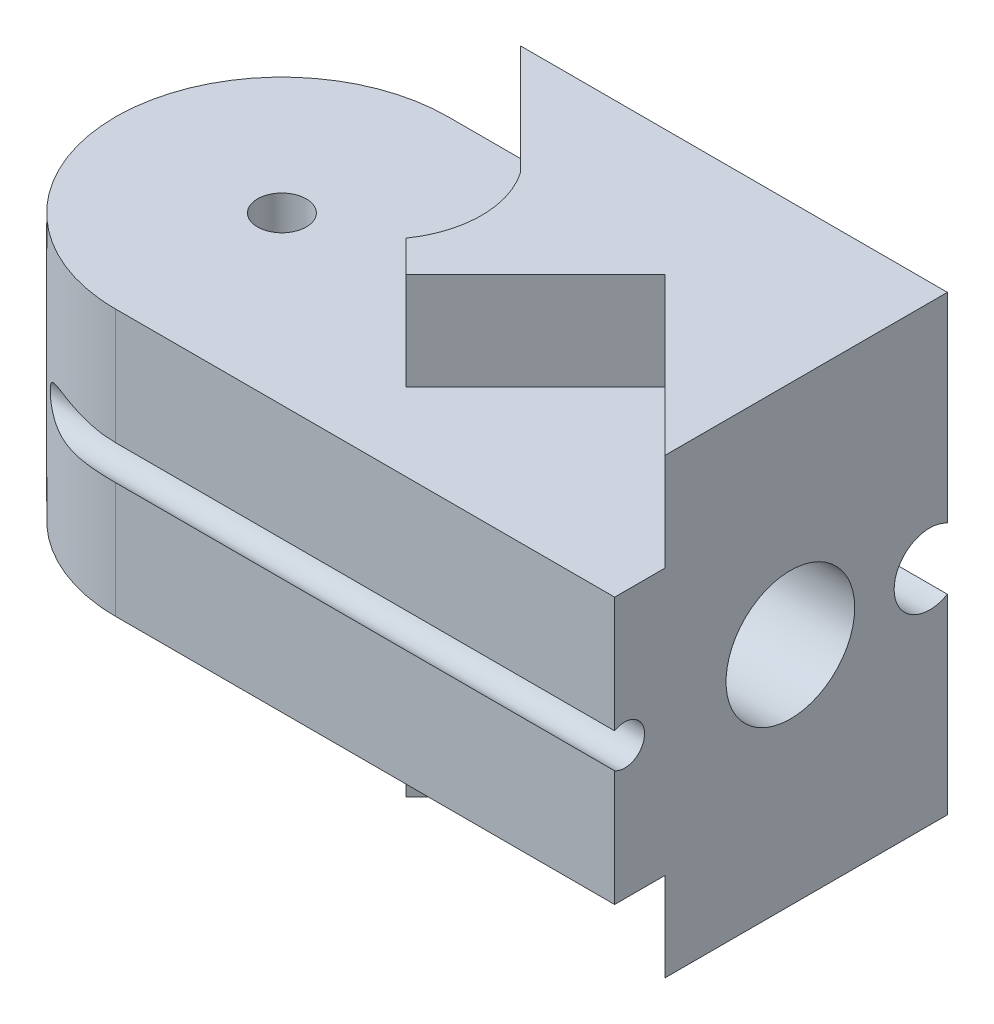
from build123d import *

# Parameters (mm, degrees)
BOSS_EXTRUDE1_DEPTH                  = 16
CUT_EXTRUDE1_DEPTH                   = 4
CUT_EXTRUDE3_DEPTH                   = 30.681644331
BOSS_EXTRUDE2_DEPTH                  = 4.4
CUT_EXTRUDE9_DEPTH                   = 33.267011126
CUT_EXTRUDE9_DEPTH_BACK              = 33.267011126
CUT_EXTRUDE10_DEPTH                  = 30.899163985
CUT_EXTRUDE10_DEPTH_BACK             = 30.899163985
SKETCH15_R                           = 2.9
RUTHEX_M3_HOLE_DEPTH                 = 8.3
F_1_6MM_PTFE_TUBE_CLAMP_CUTOUT_DEPTH = 42.426561648


with BuildPart() as part:
    # Sketch1 → Boss-Extrude1 (new body)
    with BuildSketch(Plane(origin=(0, 0, 0), x_dir=(1, 0, 0), z_dir=(0, 1, 0))):
        with BuildLine():
            Line((0, 0), (15, 0))
            Line((15, 0), (15, 20))
            Line((15, 20), (-7.5, 20))
            add(Edge.make_bspline(
                [(-7.5, 20), (-15, 20), (-15, 12.5)],
                knots=[0, 0, 0, 1.570796327, 1.570796327, 1.570796327], degree=2, weights=[1, 0.707106781, 1]))
            add(Edge.make_bspline(
                [(-15, 12.5), (-15, 5), (-7.5, 5)],
                knots=[3.141592654, 3.141592654, 3.141592654, 4.71238898, 4.71238898, 4.71238898], degree=2, weights=[1, 0.707106781, 1]))
            Line((-7.5, 5), (0, 5))
            Line((0, 5), (0, 0))
        make_face()
    extrude(amount=BOSS_EXTRUDE1_DEPTH)

    # Sketch4 → Cut-Extrude1 (cut)
    with BuildSketch(Plane(origin=(0, 0, 0), x_dir=(1, 0, 0), z_dir=(0, 1, 0))):
        with BuildLine():
            Line((7.928932188, 14.333226901), (2.100397762, 8.504692474))
            Line((2.100397762, 8.504692474), (0.686184199, 9.918906036))
            ThreePointArc((0.686184199, 9.918906036), (1.5, 12.5), (0.686184199, 15.081093964))
            Line((0.686184199, 15.081093964), (-4.232721837, 20))
            Line((-4.232721837, 20), (-7.5, 20))
            add(Edge.make_bspline(
                [(-7.5, 20), (-15, 20), (-15, 12.5), (-15, 5), (-7.5, 5)],
                knots=[4.71238898, 4.71238898, 4.71238898, 6.283185307, 6.283185307, 7.853981634, 7.853981634, 7.853981634], degree=2, weights=[1, 0.707106781, 1, 0.707106781, 1]))
            Line((-7.5, 5), (0, 5))
            Line((0, 5), (0, 0))
            Line((0, 0), (15, 0))
            Line((15, 0), (15, 7.262159089))
            Line((15, 7.262159089), (7.928932188, 14.333226901))
        make_face()
    extrude(amount=CUT_EXTRUDE1_DEPTH, mode=Mode.SUBTRACT)

    # Sketch6 → Cut-Extrude3 (cut, through all)
    with BuildSketch(Plane(origin=(0, 0, 0), x_dir=(0, 0, -1), z_dir=(1, 0, 0))):
        Polygon((0, 10), (0, 10.5), (4.59413535, 10.5), (4.59413535, 5.5), (0, 5.5), align=None)
    extrude(amount=CUT_EXTRUDE3_DEPTH, mode=Mode.SUBTRACT)

    # Sketch12 → Boss-Extrude2 (add)
    with BuildSketch(Plane(origin=(0, 16, 0), x_dir=(1, 0, 0), z_dir=(0, 1, 0))):
        with BuildLine():
            Line((7.928932188, 14.333226901), (15, 7.262159089))
            Line((15, 7.262159089), (15, 20))
            Line((15, 20), (-4.232721837, 20))
            Line((-4.232721837, 20), (0.686184199, 15.081093964))
            ThreePointArc((0.686184199, 15.081093964), (1.5, 12.5), (0.686184199, 9.918906036))
            Line((0.686184199, 9.918906036), (2.100397762, 8.504692474))
            Line((2.100397762, 8.504692474), (7.928932188, 14.333226901))
        make_face()
    extrude(amount=BOSS_EXTRUDE2_DEPTH)

    # Sketch13 → Cut-Extrude9 (cut, two sides: drawn at the far end of the back side and taken through both)
    with BuildSketch(Plane.ZY.offset(-CUT_EXTRUDE9_DEPTH_BACK)):
        Polygon((0, 5.5), (-4.59413535, 5.5), (-4.59413535, 10.5), (0, 10.5), (0, 16), (-5, 16), (-5, 4), (0, 4), align=None)
    extrude(amount=CUT_EXTRUDE9_DEPTH + CUT_EXTRUDE9_DEPTH_BACK, mode=Mode.SUBTRACT)

    # Sketch14 → Cut-Extrude10 (cut, two sides: drawn at the far end of the back side and taken through both)
    with BuildSketch(Plane.XZ.offset(-4).offset(-CUT_EXTRUDE10_DEPTH_BACK)):
        with BuildLine():
            ThreePointArc((-6.4, -12.5), (-6.722182541, -11.722182541), (-7.5, -11.4))
            Line((-7.5, -11.4), (-7.5, -12.5))
            Line((-7.5, -12.5), (-7.5, -13.6))
            ThreePointArc((-7.5, -13.6), (-6.722182541, -13.277817459), (-6.4, -12.5))
        make_face()
        with BuildLine():
            Line((-7.5, -12.5), (-7.5, -11.4))
            ThreePointArc((-7.5, -11.4), (-8.6, -12.5), (-7.5, -13.6))
            Line((-7.5, -13.6), (-7.5, -12.5))
        make_face()
    extrude(amount=CUT_EXTRUDE10_DEPTH + CUT_EXTRUDE10_DEPTH_BACK, mode=Mode.SUBTRACT)

    # Sketch15 → ruthex_m3_hole (cut)
    with BuildSketch(Plane(origin=(15, 0, 0), x_dir=(0, 0, -1), z_dir=(1, 0, 0))):
        with Locations((12.921686396, 10.181082849)):
            Circle(SKETCH15_R)
    extrude(amount=-RUTHEX_M3_HOLE_DEPTH, mode=Mode.SUBTRACT)

    # Sketch16 → 1.6mm_PTFE_tube_clamp_cutout (cut, through all)
    with BuildSketch(Plane(origin=(15, 0, 0), x_dir=(0, 0, -1), z_dir=(1, 0, 0))):
        with BuildLine():
            Line((5, 10.779422863), (5, 10))
            Line((5, 10), (6.35, 10))
            ThreePointArc((6.35, 10), (5.9, 10.779422863), (5, 10.779422863))
        make_face()
        with BuildLine():
            Line((6.35, 10), (5, 10))
            Line((5, 10), (5, 9.220577137))
            ThreePointArc((5, 9.220577137), (5.9, 9.220577137), (6.35, 10))
        make_face()
        with BuildLine():
            ThreePointArc((20, 11.385640646), (18.4, 11.385640646), (17.6, 10))
            Line((17.6, 10), (20, 10))
            Line((20, 10), (20, 11.385640646))
        make_face()
        with BuildLine():
            Line((20, 10), (17.6, 10))
            ThreePointArc((17.6, 10), (18.4, 8.614359354), (20, 8.614359354))
            Line((20, 8.614359354), (20, 10))
        make_face()
    extrude(amount=-F_1_6MM_PTFE_TUBE_CLAMP_CUTOUT_DEPTH, mode=Mode.SUBTRACT)


solid = part.part
